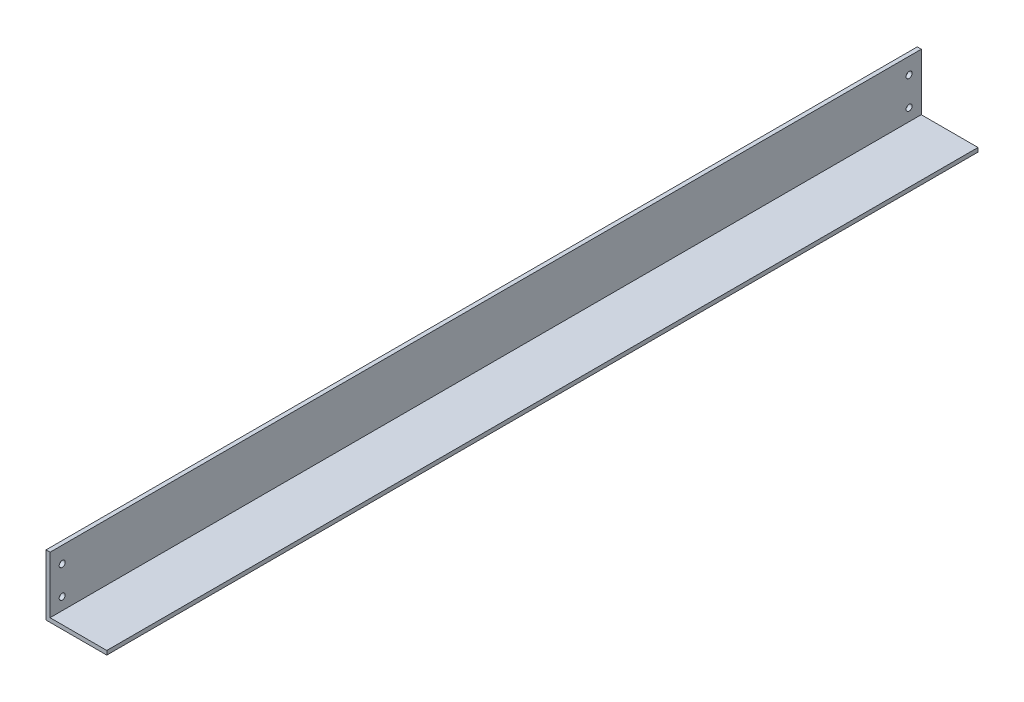
from build123d import *

# Parameters (mm, degrees)
BOSS_EXTRUDE1_DEPTH      = 410
BOSS_EXTRUDE1_DEPTH_BACK = 20
F_3_0_3_DIAMETER_HOLE2_D = 3
F_3_0_3_DIAMETER_HOLE4_D = 3


with BuildPart() as part:
    # Sketch1 → Boss-Extrude1 (new, two sides: drawn at the far end of the back side and taken through both)
    with BuildSketch(Plane.XY.offset(-BOSS_EXTRUDE1_DEPTH_BACK)):
        Polygon((0, 5.602318429), (0, 35.602318429), (2, 35.602318429), (2, 7.602318429), (30, 7.602318429), (30, 5.602318429), align=None)
    extrude(amount=BOSS_EXTRUDE1_DEPTH + BOSS_EXTRUDE1_DEPTH_BACK)

    # Ø3.0 (3) Diameter Hole2 (through all)
    with Locations(Plane(origin=(0, 369.009951222, 221.32004832), x_dir=(0, 0, -1), z_dir=(-1, 0, 0))):
        with Locations((235.32004832, 341.407632793), (235.32004832, 355.407632793)):
            Hole(F_3_0_3_DIAMETER_HOLE2_D / 2)

    # Ø3.0 (3) Diameter Hole4 (through all)
    with Locations(Plane(origin=(2, 369.009951222, 221.32004832), x_dir=(0, 0, 1), z_dir=(1, 0, 0))):
        with Locations((182.67995168, 355.407632793), (182.67995168, 341.407632793)):
            Hole(F_3_0_3_DIAMETER_HOLE4_D / 2)


solid = part.part
